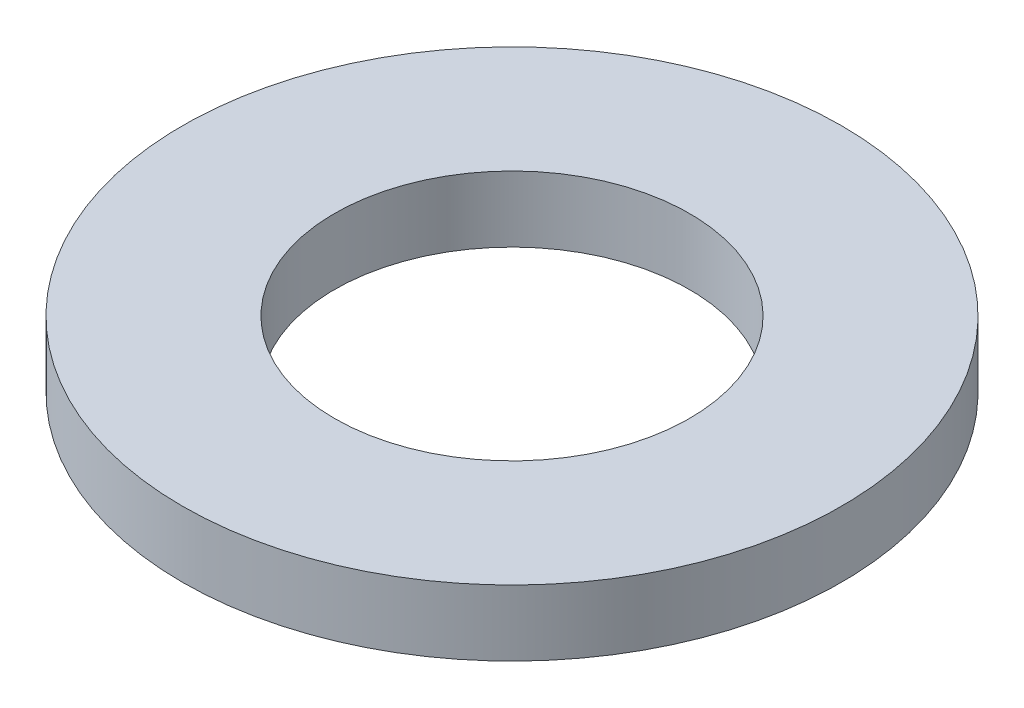
from build123d import *

# Parameters (mm, degrees)
SKETCH_1_R      = 8
SKETCH_1_R_2    = 4.31
EXTRUDE_1_DEPTH = 1.6


with BuildPart() as part:
    # Эскиз1 → Бобышка-Вытянуть1 (new body)
    with BuildSketch(Plane(origin=(0, 0, 0), x_dir=(1, 0, 0), z_dir=(0, 1, 0))):
        with Locations(Location((0, 0, 0), (0, 0, 270))):
            Circle(SKETCH_1_R)
        with Locations(Location((0, 0, 0), (0, 0, 270))):
            Circle(SKETCH_1_R_2, mode=Mode.SUBTRACT)
    extrude(amount=EXTRUDE_1_DEPTH)


solid = part.part
